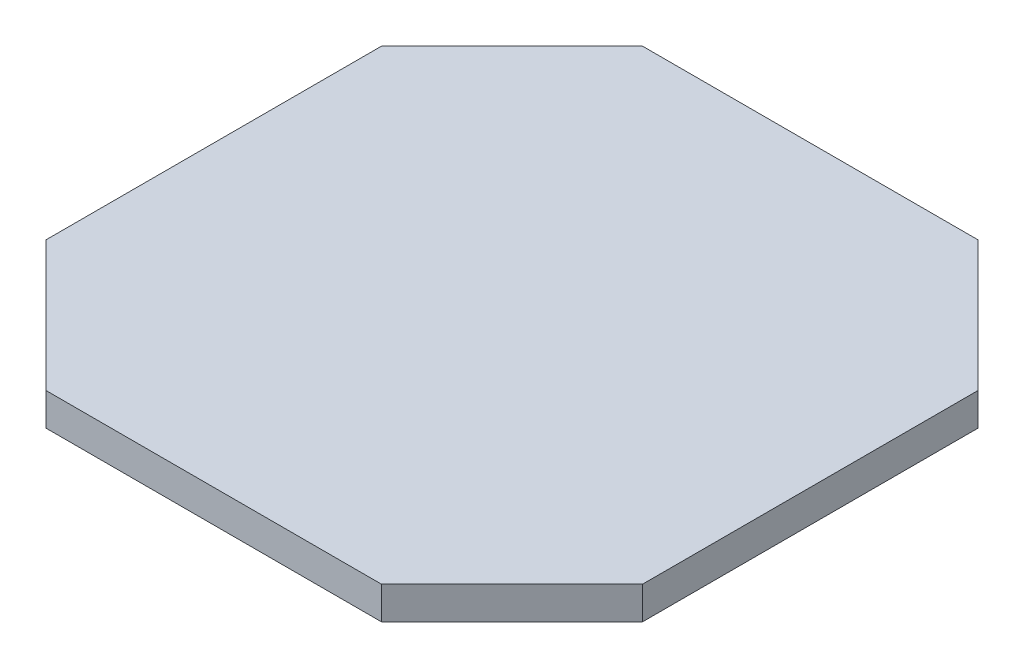
from build123d import *

# Parameters (mm, degrees)
SKETCH1_W           = 32
SKETCH1_H           = 32
BOSS_EXTRUDE1_DEPTH = 1.75
CHAMFER1_SIZE       = 7


with BuildPart() as part:
    # Sketch1 → Boss-Extrude1 (new body)
    with BuildSketch(Plane(origin=(0, 0, 0), x_dir=(1, 0, 0), z_dir=(0, 1, 0))):
        Rectangle(SKETCH1_W, SKETCH1_H)
    extrude(amount=-BOSS_EXTRUDE1_DEPTH)

    # Chamfer1
    chamfer1_edges = [part.edges().sort_by_distance(p)[0] for p in [
        (16, -0.875, 16),
        (-16, -0.875, 16),
        (-16, -0.875, -16),
        (16, -0.875, -16),
    ]]
    chamfer(chamfer1_edges, length=CHAMFER1_SIZE)


solid = part.part
